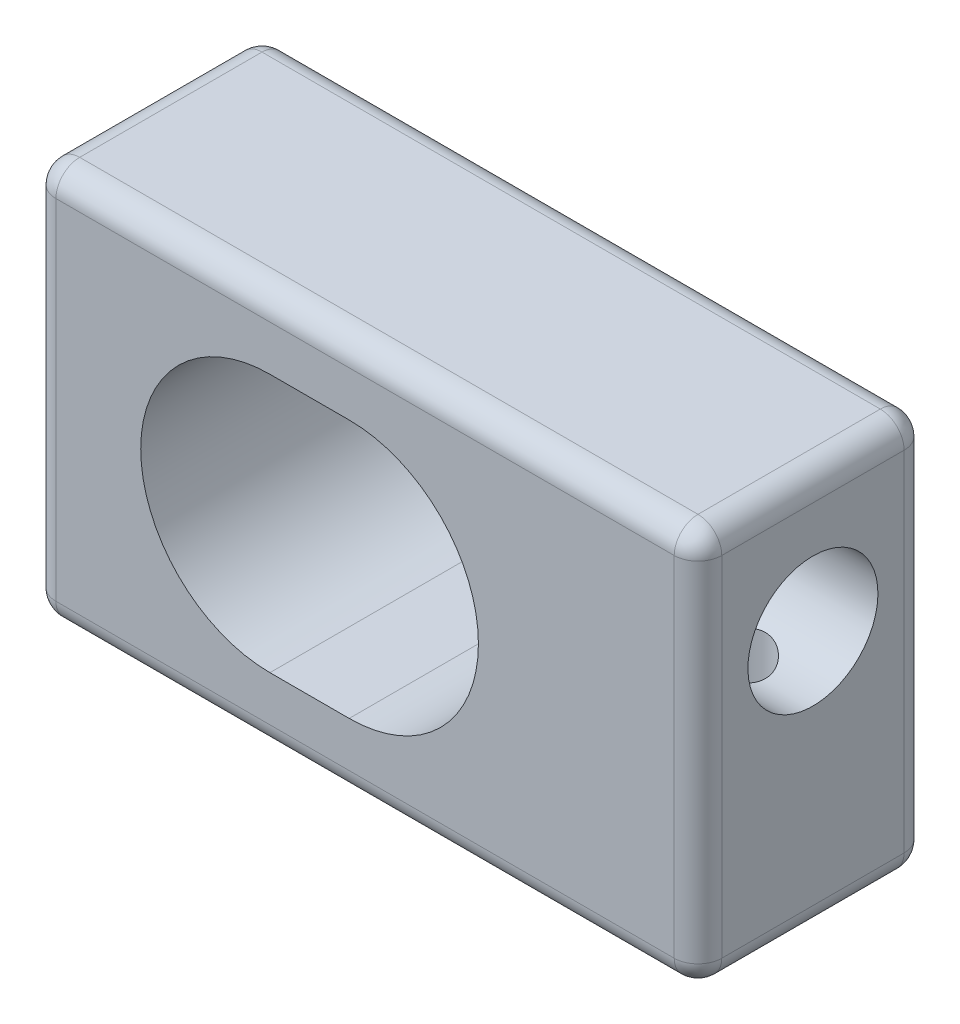
from build123d import *

# Parameters (mm, degrees)
BOSS_EXTRUDE1_DEPTH      = 7.25
BOSS_EXTRUDE1_DEPTH_BACK = 7.25
SKETCH1_W                = 42
SKETCH1_H                = 25
SKETCH2_R                = 4.1
CUT_EXTRUDE1_DEPTH       = 12
SKETCH3_R                = 2
CUT_EXTRUDE5_DEPTH       = 15
FILLET3_R                = 1.5


with BuildPart() as part:
    # Sketch1 → Boss-Extrude1 (new, two sides: drawn at the far end of the back side and taken through both)
    with BuildSketch(Plane.XY.offset(-BOSS_EXTRUDE1_DEPTH_BACK)):
        with Locations((-44, 0)):
            Rectangle(SKETCH1_W, SKETCH1_H)
        with BuildLine():
            Line((-45, -8.15), (-50, -8.15))
            ThreePointArc((-50, -8.15), (-58.15, 0), (-50, 8.15))
            Line((-50, 8.15), (-45, 8.15))
            ThreePointArc((-45, 8.15), (-36.85, 0), (-45, -8.15))
        make_face(mode=Mode.SUBTRACT)
    extrude(amount=BOSS_EXTRUDE1_DEPTH + BOSS_EXTRUDE1_DEPTH_BACK)

    # Sketch2 → Cut-Extrude1 (cut)
    with BuildSketch(Plane(origin=(-23, 0, 0), x_dir=(0, 0, -1), z_dir=(1, 0, 0))):
        with Locations((0, 4)):
            Circle(SKETCH2_R)
    extrude(amount=-CUT_EXTRUDE1_DEPTH, mode=Mode.SUBTRACT)

    # Sketch3 → Cut-Extrude5 (cut)
    with BuildSketch(Plane(origin=(0, -12.5, 0), x_dir=(1, 0, 0), z_dir=(0, 1, 0))):
        with Locations((-28, 0)):
            Circle(SKETCH3_R)
    extrude(amount=CUT_EXTRUDE5_DEPTH, mode=Mode.SUBTRACT)

    # Fillet3
    fillet3_edges = [part.edges().sort_by_distance(p)[0] for p in [
        (-65, 0, -7.25),
        (-65, 12.5, 0),
        (-65, 0, 7.25),
        (-65, -12.5, 0),
        (-23, 0, 7.25),
        (-23, 0, -7.25),
        (-44, -12.5, -7.25),
        (-44, -12.5, 7.25),
        (-44, 12.5, 7.25),
        (-23, -12.5, 0),
        (-23, 12.5, 0),
        (-44, 12.5, -7.25),
    ]]
    fillet(fillet3_edges, radius=FILLET3_R)


solid = part.part
